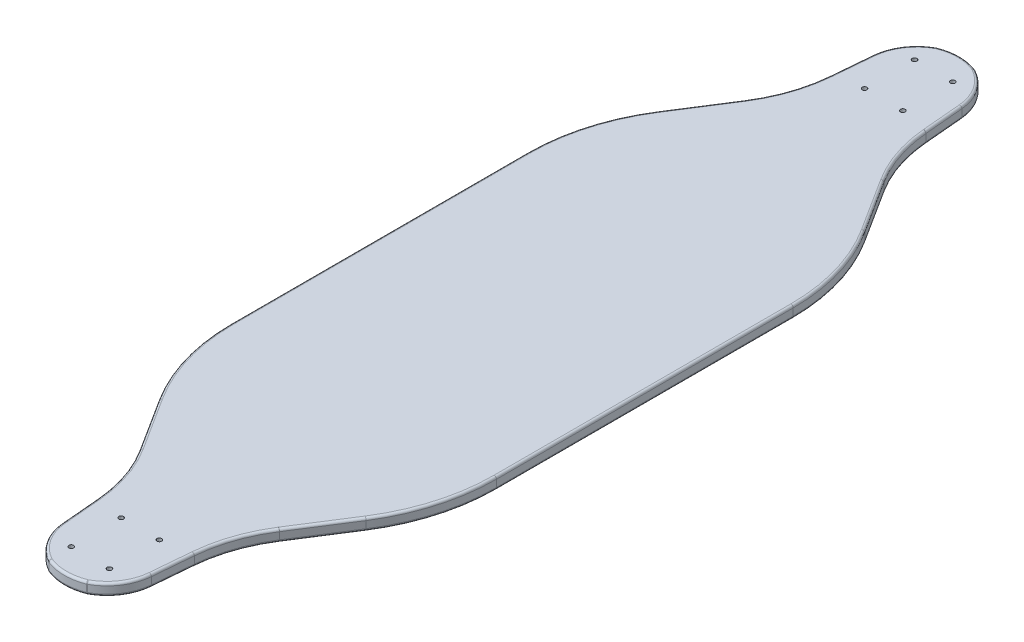
from build123d import *

# Parameters (mm, degrees)
BOSS_EXTRUDE1_DEPTH = 6.35
FILLET1_R           = 2.54
SKETCH2_R           = 2.54
CUT_EXTRUDE4_DEPTH  = 924.615663427


with BuildPart() as part:
    # Sketch1 → Boss-Extrude1 (new, symmetric)
    with BuildSketch(Plane(origin=(0, 0, 0), x_dir=(1, 0, 0), z_dir=(0, 1, 0))):
        with BuildLine():
            Line((-48.26, 9.255025399), (-51.989254389, -33.370547313))
            ThreePointArc((-51.989254389, -33.370547313), (-59.497174643, -69.07538663), (-75.276470036, -101.97247243))
            Line((-75.276470036, -101.97247243), (-111.687141789, -159.125778734))
            ThreePointArc((-111.687141789, -159.125778734), (-135.392130411, -211.443803499), (-143.51, -268.30505915))
            Line((-143.51, -268.30505915), (-143.51, -588.94494085))
            ThreePointArc((-143.51, -588.94494085), (-135.392130411, -645.806196501), (-111.687141789, -698.124221266))
            Line((-111.687141789, -698.124221266), (-75.276470036, -755.27752757))
            ThreePointArc((-75.276470036, -755.27752757), (-59.497174643, -788.17461337), (-51.989254389, -823.879452687))
            Line((-51.989254389, -823.879452687), (-48.26, -866.505025399))
            ThreePointArc((-48.26, -866.505025399), (-39.855596961, -890.770811598), (-20.979874202, -908.182573732))
            ThreePointArc((-20.979874202, -908.182573732), (-20.633589406, -908.357762273), (-20.277249721, -908.511470485))
            ThreePointArc((-20.277249721, -908.511470485), (0, -912.376266085), (20.277249721, -908.511470485))
            ThreePointArc((20.277249721, -908.511470485), (20.633589406, -908.357762273), (20.979874202, -908.182573732))
            ThreePointArc((20.979874202, -908.182573732), (39.855596961, -890.770811598), (48.26, -866.505025399))
            Line((48.26, -866.505025399), (51.989254389, -823.879452687))
            ThreePointArc((51.989254389, -823.879452687), (59.497174643, -788.17461337), (75.276470036, -755.27752757))
            Line((75.276470036, -755.27752757), (111.687141789, -698.124221266))
            ThreePointArc((111.687141789, -698.124221266), (135.392130411, -645.806196501), (143.51, -588.94494085))
            Line((143.51, -588.94494085), (143.51, -268.30505915))
            ThreePointArc((143.51, -268.30505915), (135.392130411, -211.443803499), (111.687141789, -159.125778734))
            Line((111.687141789, -159.125778734), (75.276470036, -101.97247243))
            ThreePointArc((75.276470036, -101.97247243), (59.497174643, -69.07538663), (51.989254389, -33.370547313))
            Line((51.989254389, -33.370547313), (48.26, 9.255025399))
            ThreePointArc((48.26, 9.255025399), (39.855596961, 33.520811598), (20.979874202, 50.932573732))
            ThreePointArc((20.979874202, 50.932573732), (20.633589406, 51.107762273), (20.277249721, 51.261470485))
            ThreePointArc((20.277249721, 51.261470485), (0, 55.126266085), (-20.277249721, 51.261470485))
            ThreePointArc((-20.277249721, 51.261470485), (-20.633589406, 51.107762273), (-20.979874202, 50.932573732))
            ThreePointArc((-20.979874202, 50.932573732), (-39.855596961, 33.520811598), (-48.26, 9.255025399))
        make_face()
    extrude(amount=BOSS_EXTRUDE1_DEPTH, both=True)

    # Fillet1
    fillet1_edges = [part.edges().sort_by_distance(p)[0] for p in [
        (-50.124627194, 6.35, 12.057760957),
        (-59.497174643, 6.35, 69.07538663),
        (-93.481805913, 6.35, 130.549125582),
        (-135.392130411, 6.35, 211.443803499),
        (-93.481805913, 6.35, 726.700874418),
        (-59.497174643, 6.35, 788.17461337),
        (-50.124627194, 6.35, 845.192239043),
        (-39.855596961, 6.35, 890.770811598),
        (-135.392130411, -6.35, 211.443803499),
        (-93.481805913, -6.35, 130.549125582),
        (-59.497174643, -6.35, 69.07538663),
        (-50.124627194, -6.35, 12.057760957),
        (-39.855596961, -6.35, -33.520811598),
        (-20.633589406, 6.35, 908.357762273),
        (-20.633589406, -6.35, -51.107762273),
        (0, -6.35, -55.126266085),
        (20.633589406, -6.35, -51.107762273),
        (39.855596961, -6.35, -33.520811598),
        (50.124627194, -6.35, 12.057760957),
        (59.497174643, -6.35, 69.07538663),
        (93.481805913, -6.35, 130.549125582),
        (135.392130411, -6.35, 211.443803499),
        (0, 6.35, 912.376266085),
        (143.51, -6.35, 428.625),
        (135.392130411, -6.35, 645.806196501),
        (93.481805913, -6.35, 726.700874418),
        (59.497174643, -6.35, 788.17461337),
        (50.124627194, -6.35, 845.192239043),
        (39.855596961, -6.35, 890.770811598),
        (20.633589406, -6.35, 908.357762273),
        (20.633589406, 6.35, 908.357762273),
        (0, -6.35, 912.376266085),
        (-20.633589406, -6.35, 908.357762273),
        (-39.855596961, -6.35, 890.770811598),
        (-50.124627194, -6.35, 845.192239043),
        (-59.497174643, -6.35, 788.17461337),
        (-93.481805913, -6.35, 726.700874418),
        (-143.51, 6.35, 428.625),
        (-135.392130411, -6.35, 645.806196501),
        (-143.51, -6.35, 428.625),
        (39.855596961, 6.35, 890.770811598),
        (50.124627194, 6.35, 845.192239043),
        (59.497174643, 6.35, 788.17461337),
        (93.481805913, 6.35, 726.700874418),
        (135.392130411, 6.35, 645.806196501),
        (143.51, 6.35, 428.625),
        (135.392130411, 6.35, 211.443803499),
        (93.481805913, 6.35, 130.549125582),
        (59.497174643, 6.35, 69.07538663),
        (50.124627194, 6.35, 12.057760957),
        (39.855596961, 6.35, -33.520811598),
        (20.633589406, 6.35, -51.107762273),
        (-135.392130411, 6.35, 645.806196501),
        (0, 6.35, -55.126266085),
        (-20.633589406, 6.35, -51.107762273),
        (-39.855596961, 6.35, -33.520811598),
    ]]
    fillet(fillet1_edges, radius=FILLET1_R)

    # Sketch2 → Cut-Extrude4 (cut, symmetric)
    with BuildSketch(Plane(origin=(0, 0, 0), x_dir=(1, 0, 0), z_dir=(0, 1, 0))):
        with Locations(Location((-20.6375, 26.9875, 0), (0, 0, 270))):
            Circle(SKETCH2_R)
        with Locations(Location((-20.6375, -26.9875, 0), (0, 0, 270))):
            Circle(SKETCH2_R)
        with Locations(Location((20.6375, -26.9875, 0), (0, 0, 90))):
            Circle(SKETCH2_R)
        with Locations(Location((20.6375, 26.9875, 0), (0, 0, 90))):
            Circle(SKETCH2_R)
    cut_extrude4 = extrude(amount=CUT_EXTRUDE4_DEPTH, both=True, mode=Mode.SUBTRACT)

    # Mirror1: Cut-Extrude4 across plane
    add(cut_extrude4.mirror(Plane.XY.offset(428.625)), mode=Mode.SUBTRACT)


solid = part.part
